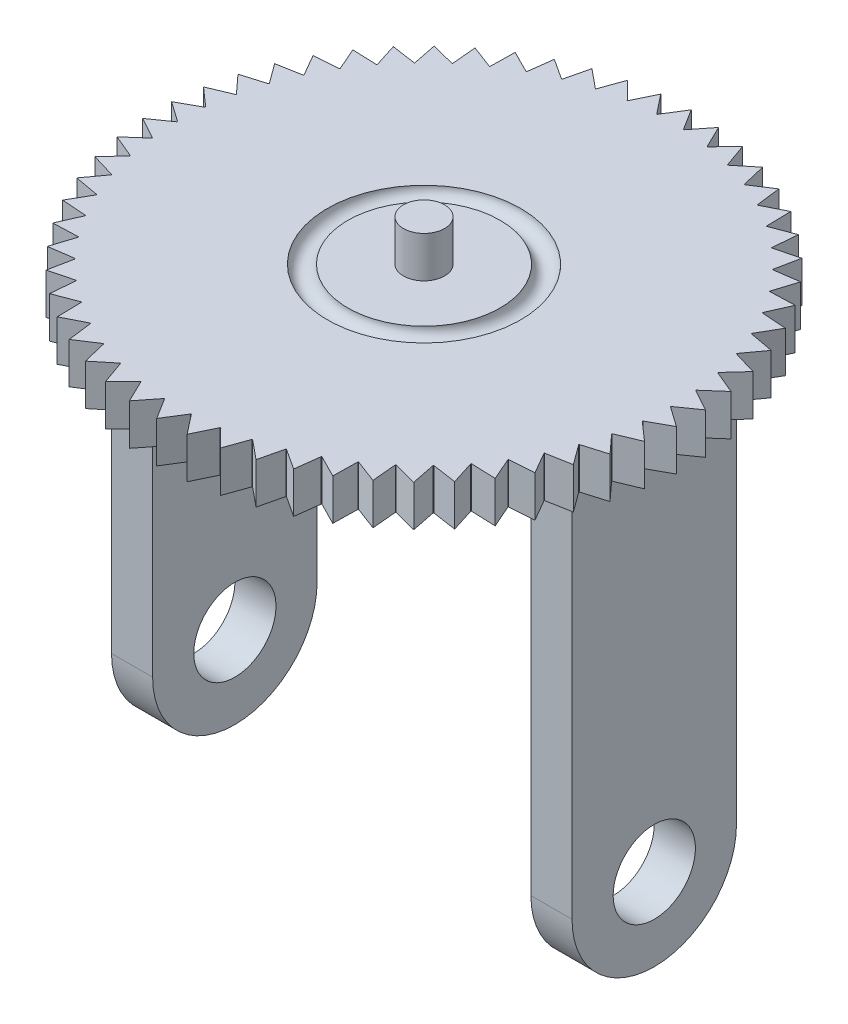
from build123d import *

# Parameters (mm, degrees)
SKETCH1_R           = 76.2
BOSS_EXTRUDE1_DEPTH = 12.7
SKETCH2_R           = 6.35
BOSS_EXTRUDE2_DEPTH = 12.7
SKETCH5_W           = 12.7
SKETCH5_H           = 50.8
BOSS_EXTRUDE3_DEPTH = 139.7
SKETCH6_R           = 12.7
CUT_EXTRUDE1_DEPTH  = 217.854127007
BOSS_EXTRUDE4_DEPTH = 12.7


with BuildPart() as part:
    # Sketch1 → Boss-Extrude1 (new body)
    with BuildSketch(Plane(origin=(0, 0, 0), x_dir=(1, 0, 0), z_dir=(0, 1, 0))):
        with Locations(Location((0, 0, 0), (0, 0, 270))):
            Circle(SKETCH1_R)
    extrude(amount=BOSS_EXTRUDE1_DEPTH)

    # Sketch2 → Boss-Extrude2 (add)
    with BuildSketch(Plane(origin=(0, 12.7, 0), x_dir=(1, 0, 0), z_dir=(0, 1, 0))):
        with Locations(Location((0, 0, 0), (0, 0, 270))):
            Circle(SKETCH2_R)
    extrude(amount=BOSS_EXTRUDE2_DEPTH)

    # Sketch4 → Cut-Revolve3 (revolve, cut)
    with BuildSketch(Plane.XY, mode=Mode.PRIVATE) as cut_revolve3_sk:
        with BuildLine():
            Line((-29.845, 12.7), (-23.495, 12.7))
            ThreePointArc((-23.495, 12.7), (-26.67, 9.525), (-29.845, 12.7))
        make_face()
    revolve(cut_revolve3_sk.sketch.rotate(Axis((0, 0, 0), (0, 1, 0)), 270), axis=Axis((0, 0, 0), (0, 1, 0)), mode=Mode.SUBTRACT)

    # Sketch5 → Boss-Extrude3 (add)
    with BuildSketch(Plane.XZ):
        with Locations((64.77, 0)):
            Rectangle(SKETCH5_W, SKETCH5_H)
        with Locations((-64.77, 0)):
            Rectangle(SKETCH5_W, SKETCH5_H)
    extrude(amount=BOSS_EXTRUDE3_DEPTH)

    # Sketch6 → Cut-Extrude1 (cut, through all)
    with BuildSketch(Plane.ZY.offset(71.12)):
        with BuildLine():
            ThreePointArc((7.5e-08, -139.7), (-17.960512216, -132.260512269), (-25.4, -114.3))
            Line((-25.4, -114.3), (-25.4, -139.7))
            Line((-25.4, -139.7), (7.5e-08, -139.7))
        make_face()
        with BuildLine():
            ThreePointArc((25.4, -114.3), (17.960512269, -132.260512216), (7.5e-08, -139.7))
            Line((7.5e-08, -139.7), (25.4, -139.7))
            Line((25.4, -139.7), (25.4, -114.3))
        make_face()
        with Locations((0, -114.3)):
            Circle(SKETCH6_R)
    extrude(amount=-CUT_EXTRUDE1_DEPTH, mode=Mode.SUBTRACT)

    # Sketch7 → Boss-Extrude4 (add)
    with BuildSketch(Plane(origin=(0, 12.7, 0), x_dir=(1, 0, 0), z_dir=(0, 1, 0))):
        Polygon((0, 82.55), (-4.045440703, 76.092538462), (4.045440703, 76.092538462), align=None)
        Polygon((4.205324412, 76.083869819), (12.248776724, 75.209091663), (8.925224971, 82.066088363), align=None)
        Polygon((12.406785943, 75.183187366), (20.308507037, 73.443887029), (17.745809839, 80.620026874), align=None)
        Polygon((20.462789252, 73.401050783), (28.130138673, 70.81761997), (26.358341313, 78.228769281), align=None)
        Polygon((28.278885067, 70.75835399), (35.621970154, 67.361081066), (34.661845334, 74.920350894), align=None)
        Polygon((35.763436809, 67.286080192), (42.696166603, 63.114795075), (42.55897091, 70.733559893), align=None)
        Polygon((42.828694954, 63.024938624), (49.269789537, 58.128545819), (49.957131464, 65.717482574), align=None)
        Polygon((49.39182581, 58.024887274), (55.265769236, 52.46079251), (56.769590328, 59.930927858), align=None)
        Polygon((55.375882667, 52.344547174), (60.613808321, 46.177984374), (62.916477651, 53.441737809), align=None)
        Polygon((60.71070793, 46.050515118), (65.251205923, 39.353781593), (68.325726798, 46.325992246), align=None)
        Polygon((65.333755652, 39.216582876), (69.123592795, 32.068191704), (72.933919269, 38.66711678), align=None)
        Polygon((69.190824823, 31.922872056), (72.185568742, 24.406631587), (76.687028221, 30.554904723), align=None)
        Polygon((72.236694836, 24.254894748), (74.401234895, 16.45892603), (79.541051883, 22.084464346), align=None)
        Polygon((74.435655648, 16.302550976), (75.744614595, 8.318254614), (81.462529436, 13.355103815), align=None)
        Polygon((75.761926454, 8.159074699), (76.199957943, 0.080059268), (82.428933313, 4.469166904), align=None)
        Polygon((76.199957943, -0.080059268), (75.761926454, -8.159074699), (82.428933313, -4.469166904), align=None)
        Polygon((75.744614595, -8.318254614), (74.435655648, -16.302550976), (81.462529436, -13.355103815), align=None)
        Polygon((74.401234895, -16.45892603), (72.236694836, -24.254894748), (79.541051883, -22.084464346), align=None)
        Polygon((72.185568742, -24.406631587), (69.190824823, -31.922872055), (76.687028221, -30.554904723), align=None)
        Polygon((69.123592795, -32.068191704), (65.333755652, -39.216582876), (72.933919269, -38.66711678), align=None)
        Polygon((65.251205923, -39.353781593), (60.71070793, -46.050515117), (68.325726798, -46.325992246), align=None)
        Polygon((60.613808321, -46.177984374), (55.375882667, -52.344547174), (62.916477651, -53.441737809), align=None)
        Polygon((55.265769236, -52.46079251), (49.39182581, -58.024887274), (56.769590328, -59.930927858), align=None)
        Polygon((49.269789537, -58.128545819), (42.828694955, -63.024938624), (49.957131464, -65.717482574), align=None)
        Polygon((42.696166603, -63.114795075), (35.763436809, -67.286080192), (42.55897091, -70.733559893), align=None)
        Polygon((35.621970154, -67.361081066), (28.278885067, -70.75835399), (34.661845334, -74.920350894), align=None)
        Polygon((28.130138674, -70.81761997), (20.462789252, -73.401050783), (26.358341313, -78.228769281), align=None)
        Polygon((20.308507037, -73.443887029), (12.406785943, -75.183187366), (17.74580984, -80.620026874), align=None)
        Polygon((12.248776724, -75.209091663), (4.205324412, -76.083869819), (8.925224971, -82.066088363), align=None)
        Polygon((4.045440703, -76.092538462), (-4.045440703, -76.092538462), (0, -82.55), align=None)
        Polygon((-4.205324412, -76.083869819), (-12.248776724, -75.209091663), (-8.925224971, -82.066088363), align=None)
        Polygon((-12.406785943, -75.183187366), (-20.308507037, -73.443887029), (-17.745809839, -80.620026874), align=None)
        Polygon((-20.462789252, -73.401050783), (-28.130138673, -70.81761997), (-26.358341313, -78.228769281), align=None)
        Polygon((-28.278885066, -70.75835399), (-35.621970153, -67.361081066), (-34.661845334, -74.920350894), align=None)
        Polygon((-35.763436809, -67.286080192), (-42.696166603, -63.114795075), (-42.55897091, -70.733559893), align=None)
        Polygon((-42.828694954, -63.024938624), (-49.269789537, -58.128545819), (-49.957131464, -65.717482574), align=None)
        Polygon((-49.39182581, -58.024887274), (-55.265769236, -52.46079251), (-56.769590328, -59.930927858), align=None)
        Polygon((-55.375882667, -52.344547174), (-60.61380832, -46.177984374), (-62.916477651, -53.441737809), align=None)
        Polygon((-60.71070793, -46.050515118), (-65.251205922, -39.353781593), (-68.325726798, -46.325992246), align=None)
        Polygon((-65.333755652, -39.216582876), (-69.123592795, -32.068191704), (-72.933919269, -38.66711678), align=None)
        Polygon((-69.190824823, -31.922872056), (-72.185568742, -24.406631587), (-76.687028221, -30.554904723), align=None)
        Polygon((-72.236694835, -24.254894748), (-74.401234895, -16.45892603), (-79.541051882, -22.084464346), align=None)
        Polygon((-74.435655647, -16.302550976), (-75.744614595, -8.318254614), (-81.462529436, -13.355103815), align=None)
        Polygon((-75.761926454, -8.159074699), (-76.199957943, -0.080059268), (-82.428933313, -4.469166904), align=None)
        Polygon((-76.199957943, 0.080059268), (-75.761926454, 8.159074699), (-82.428933313, 4.469166904), align=None)
        Polygon((-75.744614595, 8.318254614), (-74.435655647, 16.302550976), (-81.462529436, 13.355103815), align=None)
        Polygon((-74.401234895, 16.45892603), (-72.236694836, 24.254894748), (-79.541051882, 22.084464346), align=None)
        Polygon((-72.185568742, 24.406631587), (-69.190824823, 31.922872055), (-76.687028221, 30.554904723), align=None)
        Polygon((-69.123592795, 32.068191704), (-65.333755652, 39.216582876), (-72.933919269, 38.66711678), align=None)
        Polygon((-65.251205922, 39.353781593), (-60.71070793, 46.050515118), (-68.325726798, 46.325992246), align=None)
        Polygon((-60.613808321, 46.177984374), (-55.375882667, 52.344547174), (-62.916477651, 53.441737809), align=None)
        Polygon((-55.265769236, 52.46079251), (-49.39182581, 58.024887274), (-56.769590328, 59.930927858), align=None)
        Polygon((-49.269789537, 58.128545819), (-42.828694954, 63.024938624), (-49.957131464, 65.717482574), align=None)
        Polygon((-42.696166603, 63.114795075), (-35.763436809, 67.286080192), (-42.55897091, 70.733559893), align=None)
        Polygon((-35.621970154, 67.361081066), (-28.278885067, 70.75835399), (-34.661845334, 74.920350894), align=None)
        Polygon((-28.130138673, 70.81761997), (-20.462789252, 73.401050783), (-26.358341313, 78.228769281), align=None)
        Polygon((-20.308507037, 73.443887029), (-12.406785943, 75.183187366), (-17.745809839, 80.620026874), align=None)
        Polygon((-12.248776724, 75.209091663), (-4.205324412, 76.083869819), (-8.925224971, 82.066088363), align=None)
    extrude(amount=-BOSS_EXTRUDE4_DEPTH)


solid = part.part
